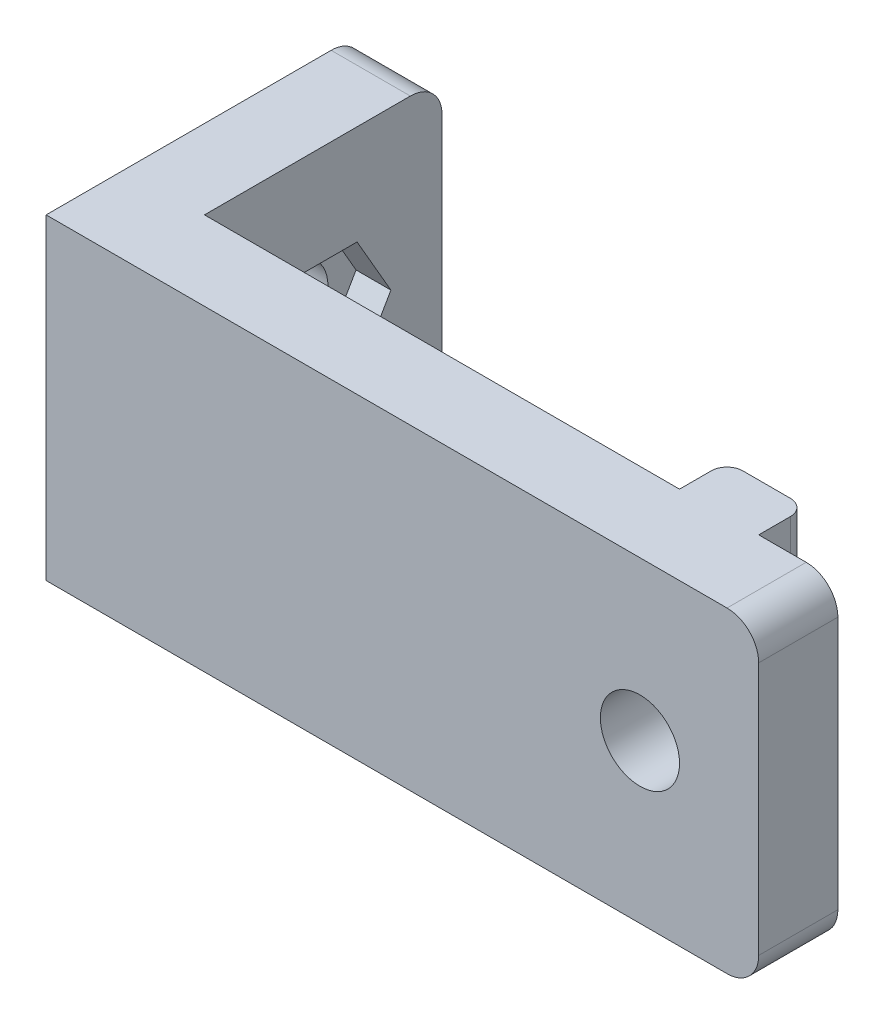
from build123d import *

# Parameters (mm, degrees)
SKETCH1_W           = 45
SKETCH1_H           = 20
BOSS_EXTRUDE1_DEPTH = 5
SKETCH2_W           = 5
SKETCH2_H           = 20
BOSS_EXTRUDE2_DEPTH = 15
SKETCH3_R           = 2.5
CUT_EXTRUDE1_DEPTH  = 15
SKETCH4_R           = 2.5
CUT_EXTRUDE2_DEPTH  = 15
SKETCH5_W           = 5
SKETCH5_H           = 4
BOSS_EXTRUDE3_DEPTH = 3
FILLET1_R           = 1
FILLET2_R           = 2
CUT_EXTRUDE3_DEPTH  = 2.2


with BuildPart() as part:
    # Sketch1 → Boss-Extrude1 (new body)
    with BuildSketch(Plane.XY):
        Rectangle(SKETCH1_W, SKETCH1_H)
    extrude(amount=BOSS_EXTRUDE1_DEPTH)

    # Sketch2 → Boss-Extrude2 (add)
    with BuildSketch(Plane(origin=(0, 0, 0), x_dir=(-1, 0, 0), z_dir=(0, 0, -1))):
        with Locations((20, 0)):
            Rectangle(SKETCH2_W, SKETCH2_H)
    extrude(amount=BOSS_EXTRUDE2_DEPTH)

    # Sketch3 → Cut-Extrude1 (cut)
    with BuildSketch(Plane(origin=(-17.5, 0, 0), x_dir=(0, 0, -1), z_dir=(1, 0, 0))):
        with Locations(Location((7.5, 0, 0), (0, 0, 90))):
            Circle(SKETCH3_R)
    extrude(amount=-CUT_EXTRUDE1_DEPTH, mode=Mode.SUBTRACT)

    # Sketch4 → Cut-Extrude2 (cut)
    with BuildSketch(Plane.XY.offset(5)):
        with Locations((15, 0)):
            Circle(SKETCH4_R)
    extrude(amount=-CUT_EXTRUDE2_DEPTH, mode=Mode.SUBTRACT)

    # Sketch5 → Boss-Extrude3 (add)
    with BuildSketch(Plane(origin=(0, 0, 0), x_dir=(-1, 0, 0), z_dir=(0, 0, -1))):
        with Locations((-15, 8)):
            Rectangle(SKETCH5_W, SKETCH5_H)
        with Locations((-15, -8)):
            Rectangle(SKETCH5_W, SKETCH5_H)
    extrude(amount=BOSS_EXTRUDE3_DEPTH)

    # Fillet1
    fillet1_edges = [part.edges().sort_by_distance(p)[0] for p in [
        (17.5, 8, -3),
        (12.5, 8, -3),
        (12.5, -8, -3),
        (17.5, -8, -3),
    ]]
    fillet(fillet1_edges, radius=FILLET1_R)

    # Fillet2
    fillet2_edges = [part.edges().sort_by_distance(p)[0] for p in [
        (-20, 10, -15),
        (-20, -10, -15),
        (22.5, 10, 2.5),
        (22.5, -10, 2.5),
    ]]
    fillet(fillet2_edges, radius=FILLET2_R)

    # Sketch6 → Cut-Extrude3 (cut)
    with BuildSketch(Plane(origin=(-17.5, 0, 0), x_dir=(0, 0, -1), z_dir=(1, 0, 0))):
        Polygon((3.227608008, 0), (5.363804004, -3.7), (9.636195996, -3.7), (11.772391992, 0), (9.636195996, 3.7), (5.363804004, 3.7), align=None)
    extrude(amount=-CUT_EXTRUDE3_DEPTH, mode=Mode.SUBTRACT)


solid = part.part
